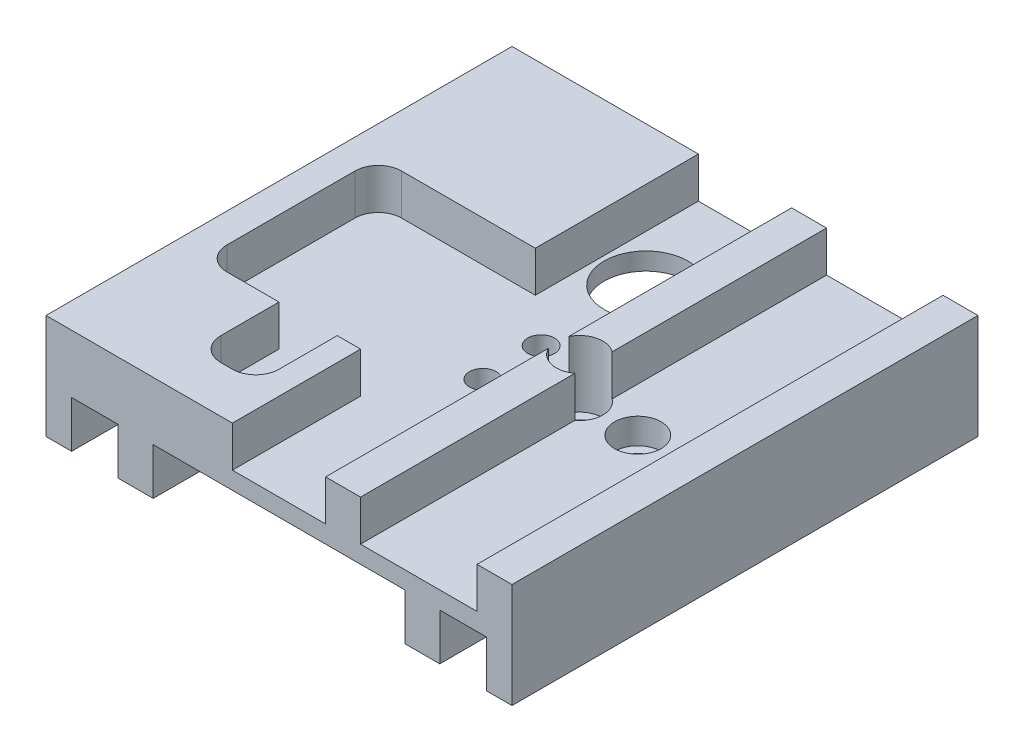
from build123d import *

# Parameters (mm, degrees)
SKETCH_1_W           = 40
SKETCH_1_H           = 40
EXTRUDE_1_DEPTH      = 9
SKETCH_2_W           = 8
SKETCH_2_H           = 40
CUT_EXTRUDE_1_DEPTH  = 3.5
SKETCH_3_R           = 1.15
CUT_EXTRUDE_2_DEPTH  = 58.280013966
SKETCH_4_R           = 2
CUT_EXTRUDE_3_DEPTH  = 2.4
SKETCH_5_R           = 1.2
CUT_EXTRUDE_4_DEPTH  = 58.280013966
SKETCH_6_R           = 2
CUT_EXTRUDE_5_DEPTH  = 5.7
SKETCH_7_W           = 13.47912662
SKETCH_7_H           = 15
CUT_EXTRUDE_6_DEPTH  = 3.5
SKETCH_12_W          = 4
SKETCH_12_H          = 40
SKETCH_12_W_2        = 21.6
SKETCH_12_H_2        = 12
SKETCH_12_H_3        = 14
CUT_EXTRUDE_11_DEPTH = 4
FILLET_3_R           = 2
SKETCH_15_R          = 3.6
CUT_EXTRUDE_13_DEPTH = 4
SKETCH_16_W          = 5
SKETCH_16_H          = 7
CUT_EXTRUDE_14_DEPTH = 3.5
SKETCH_17_R          = 1.5
CUT_EXTRUDE_15_DEPTH = 3.5
FILLET_5_R           = 2
SKETCH_18_W          = 10
SKETCH_18_H          = 40
CUT_EXTRUDE_16_DEPTH = 3.5


with BuildPart() as part:
    # 草图1 → 凸台-拉伸1 (new body)
    with BuildSketch(Plane(origin=(0, 0, 0), x_dir=(1, 0, 0), z_dir=(0, 1, 0))):
        with Locations((20, -20)):
            Rectangle(SKETCH_1_W, SKETCH_1_H)
    extrude(amount=EXTRUDE_1_DEPTH)

    # 草图2 → 切除-拉伸1 (cut)
    with BuildSketch(Plane(origin=(0, 9, 0), x_dir=(1, 0, 0), z_dir=(0, 1, 0))):
        with Locations((20, -20)):
            Rectangle(SKETCH_2_W, SKETCH_2_H)
    extrude(amount=-CUT_EXTRUDE_1_DEPTH, mode=Mode.SUBTRACT)

    # 草图3 → 切除-拉伸2 (cut, through all)
    with BuildSketch(Plane(origin=(0, 0, 0), x_dir=(-1, 0, 0), z_dir=(0, -1, 0))):
        with Locations(Location((-20, -22.5, 0), (0, 0, 90))):
            Circle(SKETCH_3_R)
        with Locations(Location((-20, -17.5, 0), (0, 0, 90))):
            Circle(SKETCH_3_R)
    extrude(amount=-CUT_EXTRUDE_2_DEPTH, mode=Mode.SUBTRACT)

    # 草图4 → 切除-拉伸3 (cut)
    with BuildSketch(Plane(origin=(0, 0, 0), x_dir=(-1, 0, 0), z_dir=(0, -1, 0))):
        with Locations(Location((-20, -22.5, 0), (0, 0, 90))):
            Circle(SKETCH_4_R)
        with Locations(Location((-20, -17.5, 0), (0, 0, 90))):
            Circle(SKETCH_4_R)
    extrude(amount=-CUT_EXTRUDE_3_DEPTH, mode=Mode.SUBTRACT)

    # 草图5 → 切除-拉伸4 (cut, through all)
    with BuildSketch(Plane(origin=(0, 9, 0), x_dir=(1, 0, 0), z_dir=(0, 1, 0))):
        with Locations(Location((25.8, -20, 0), (0, 0, 270))):
            Circle(SKETCH_5_R)
        with Locations(Location((30.8, -20, 0), (0, 0, 270))):
            Circle(SKETCH_5_R)
    extrude(amount=-CUT_EXTRUDE_4_DEPTH, mode=Mode.SUBTRACT)

    # 草图6 → 切除-拉伸5 (cut)
    with BuildSketch(Plane(origin=(0, 9, 0), x_dir=(1, 0, 0), z_dir=(0, 1, 0))):
        with Locations(Location((30.8, -20, 0), (0, 0, 270))):
            Circle(SKETCH_6_R)
        with Locations(Location((25.8, -20, 0), (0, 0, 270))):
            Circle(SKETCH_6_R)
    extrude(amount=-CUT_EXTRUDE_5_DEPTH, mode=Mode.SUBTRACT)

    # 草图7 → 切除-拉伸6 (cut)
    with BuildSketch(Plane(origin=(0, 9, 0), x_dir=(1, 0, 0), z_dir=(0, 1, 0))):
        with Locations((9.26043669, -21.5)):
            Rectangle(SKETCH_7_W, SKETCH_7_H)
    extrude(amount=-CUT_EXTRUDE_6_DEPTH, mode=Mode.SUBTRACT)

    # 草图12 → 切除-拉伸11 (cut)
    with BuildSketch(Plane(origin=(0, 0, 0), x_dir=(-1, 0, 0), z_dir=(0, -1, 0))):
        with Locations((-4.2, -20)):
            Rectangle(SKETCH_12_W, SKETCH_12_H)
        with Locations((-35.8, -20)):
            Rectangle(SKETCH_12_W, SKETCH_12_H)
        with Locations((-20, -6)):
            Rectangle(SKETCH_12_W_2, SKETCH_12_H_2)
        with Locations((-20, -33)):
            Rectangle(SKETCH_12_W_2, SKETCH_12_H_3)
    extrude(amount=-CUT_EXTRUDE_11_DEPTH, mode=Mode.SUBTRACT)

    # 圆角3
    fillet_3_edges = [part.edges().sort_by_distance(p)[0] for p in [
        (30.8, 2, 12),
        (9.2, 2, 12),
        (9.2, 2, 26),
        (30.8, 2, 26),
    ]]
    fillet(fillet_3_edges, radius=FILLET_3_R)

    # 草图15 → 切除-拉伸13 (cut)
    with BuildSketch(Plane(origin=(0, 5.5, 0), x_dir=(1, 0, 0), z_dir=(0, 1, 0))):
        with Locations(Location((20, -8.5, 0), (0, 0, 270))):
            Circle(SKETCH_15_R)
    extrude(amount=-CUT_EXTRUDE_13_DEPTH, mode=Mode.SUBTRACT)

    # 草图16 → 切除-拉伸14 (cut)
    with BuildSketch(Plane(origin=(0, 9, 0), x_dir=(1, 0, 0), z_dir=(0, 1, 0))):
        with Locations((11.5, -32.5)):
            Rectangle(SKETCH_16_W, SKETCH_16_H)
    extrude(amount=-CUT_EXTRUDE_14_DEPTH, mode=Mode.SUBTRACT)

    # 草图17 → 切除-拉伸15 (cut)
    with BuildSketch(Plane(origin=(0, 5.5, 0), x_dir=(1, 0, 0), z_dir=(0, 1, 0))):
        with Locations(Location((11.5, -34, 0), (0, 0, 270))):
            Circle(SKETCH_17_R)
    extrude(amount=-CUT_EXTRUDE_15_DEPTH, mode=Mode.SUBTRACT)

    # 圆角5
    fillet_5_edges = [part.edges().sort_by_distance(p)[0] for p in [
        (9, 7.25, 36),
        (14, 7.25, 36),
        (2.52087338, 7.25, 29),
        (2.52087338, 7.25, 14),
    ]]
    fillet(fillet_5_edges, radius=FILLET_5_R)

    # 草图18 → 切除-拉伸16 (cut)
    with BuildSketch(Plane(origin=(0, 9, 0), x_dir=(1, 0, 0), z_dir=(0, 1, 0))):
        with Locations((32, -20)):
            Rectangle(SKETCH_18_W, SKETCH_18_H)
    extrude(amount=-CUT_EXTRUDE_16_DEPTH, mode=Mode.SUBTRACT)


solid = part.part
